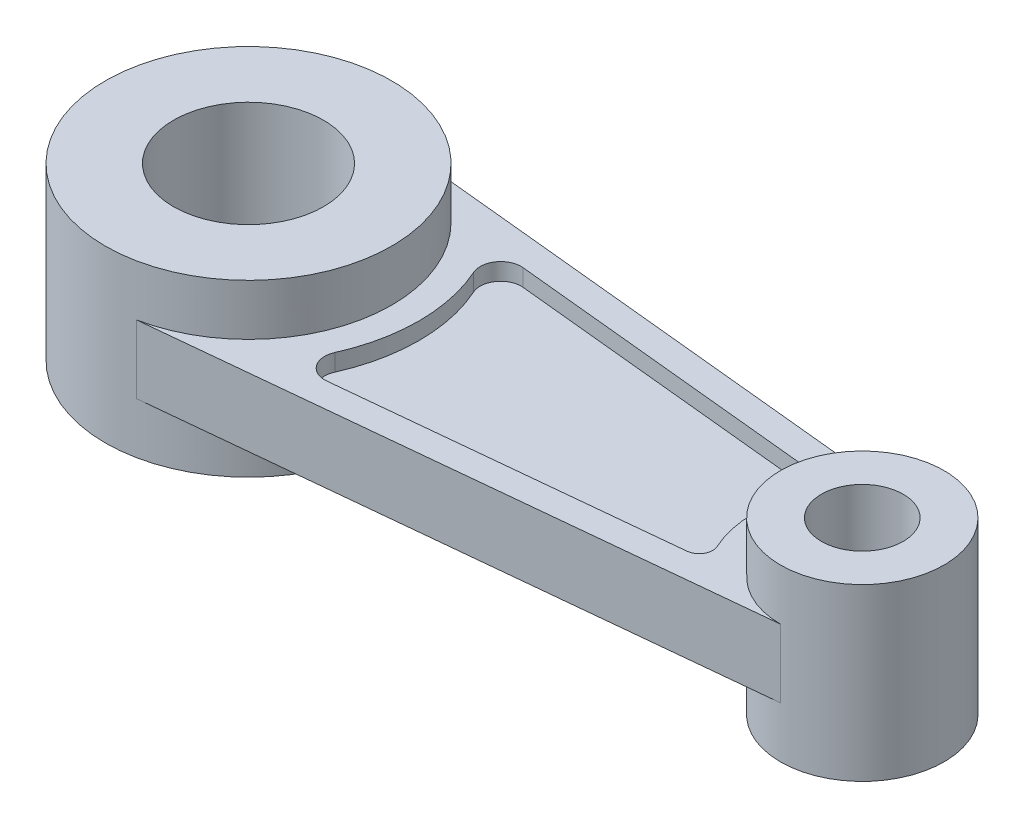
from build123d import *
from build123d.topology import SkipClean

# Parameters (mm, degrees)
BOSS_EXTRUDE1_DEPTH = 10
SKETCH2_R           = 21
SKETCH2_R_2         = 12
BOSS_EXTRUDE2_DEPTH = 17.5
BOSS_EXTRUDE3_START = 7.5
SKETCH3_R           = 21
SKETCH3_R_2         = 12
BOSS_EXTRUDE3_DEPTH = 7.5
SKETCH4_R           = 11
SKETCH4_R_2         = 6
CUT_EXTRUDE1_DEPTH  = 38.5
CUT_EXTRUDE2_DEPTH  = 2.5
CUT_EXTRUDE3_START  = -2.5
CUT_EXTRUDE3_DEPTH  = 2.5


with BuildPart() as part:
    # Sketch1 → Boss-Extrude1 (new body)
    with BuildSketch(Plane(origin=(0, 0, 0), x_dir=(1, 0, 0), z_dir=(0, 1, 0))):
        with BuildLine():
            Line((0, 21), (90, 12))
            ThreePointArc((90, 12), (102, 0), (90, -12))
            Line((90, -12), (0, -21))
            ThreePointArc((0, -21), (-21, 0), (0, 21))
        make_face()
    extrude(amount=-BOSS_EXTRUDE1_DEPTH)

    # Sketch2 → Boss-Extrude2 (add)
    with SkipClean():  # the faces are left unmerged after this step: merging them gives an invalid solid
        with BuildSketch(Plane(origin=(0, 0, 0), x_dir=(1, 0, 0), z_dir=(0, 1, 0))):
            with Locations(Location((0, 0, 0), (0, 0, 270))):
                Circle(SKETCH2_R)
            with Locations(Location((90, 0, 0), (0, 0, 270))):
                Circle(SKETCH2_R_2)
        extrude(amount=-BOSS_EXTRUDE2_DEPTH)

    # Sketch3 → Boss-Extrude3 (add)
    with SkipClean():  # the faces are left unmerged after this step: merging them gives an invalid solid
        with BuildSketch(Plane(origin=(0, 0, 0), x_dir=(1, 0, 0), z_dir=(0, 1, 0)).offset(BOSS_EXTRUDE3_START)):
            with Locations(Location((0, 0, 0), (0, 0, 270))):
                Circle(SKETCH3_R)
            with Locations(Location((90, 0, 0), (0, 0, 270))):
                Circle(SKETCH3_R_2)
        extrude(amount=-BOSS_EXTRUDE3_DEPTH)

    # Sketch4 → Cut-Extrude1 (cut)
    with SkipClean():  # the faces are left unmerged after this step: merging them gives an invalid solid
        with BuildSketch(Plane(origin=(0, 7.5, 0), x_dir=(1, 0, 0), z_dir=(0, 1, 0))):
            with Locations(Location((0, 0, 0), (0, 0, 270))):
                Circle(SKETCH4_R)
            with Locations(Location((90, 0, 0), (0, 0, 270))):
                Circle(SKETCH4_R_2)
        extrude(amount=-CUT_EXTRUDE1_DEPTH, mode=Mode.SUBTRACT)

    # Sketch5 → Cut-Extrude2 (cut)
    with SkipClean():  # the faces are left unmerged after this step: merging them gives an invalid solid
        with BuildSketch(Plane(origin=(0, 0, 0), x_dir=(1, 0, 0), z_dir=(0, 1, 0))):
            with BuildLine():
                Line((25.869138462, 14.393135905), (73.882928765, 9.591756875))
                ThreePointArc((73.882928765, 9.591756875), (75.42197475, 8.591212838), (75.496818958, 6.757051106))
                ThreePointArc((75.496818958, 6.757051106), (74, 0), (75.496818958, -6.757051106))
                ThreePointArc((75.496818958, -6.757051106), (75.42197475, -8.591212838), (73.882928765, -9.591756875))
                Line((73.882928765, -9.591756875), (25.869138462, -14.393135905))
                ThreePointArc((25.869138462, -14.393135905), (23.13846438, -13.164322574), (22.830917237, -10.185736013))
                ThreePointArc((22.830917237, -10.185736013), (25, 0), (22.830917237, 10.185736013))
                ThreePointArc((22.830917237, 10.185736013), (23.13846438, 13.164322574), (25.869138462, 14.393135905))
            make_face()
        extrude(amount=-CUT_EXTRUDE2_DEPTH, mode=Mode.SUBTRACT)

    # Sketch7 → Cut-Extrude3 (cut)
    with SkipClean():  # the faces are left unmerged after this step: merging them gives an invalid solid
        with BuildSketch(Plane.XZ.offset(10).offset(CUT_EXTRUDE3_START)):
            with BuildLine():
                Line((25.869138462, 14.393135905), (73.882928765, 9.591756875))
                ThreePointArc((73.882928765, 9.591756875), (75.42197475, 8.591212838), (75.496818958, 6.757051106))
                ThreePointArc((75.496818958, 6.757051106), (74, 0), (75.496818958, -6.757051106))
                ThreePointArc((75.496818958, -6.757051106), (75.42197475, -8.591212838), (73.882928765, -9.591756875))
                Line((73.882928765, -9.591756875), (25.869138462, -14.393135905))
                ThreePointArc((25.869138462, -14.393135905), (23.13846438, -13.164322574), (22.830917237, -10.185736013))
                ThreePointArc((22.830917237, -10.185736013), (25, 0), (22.830917237, 10.185736013))
                ThreePointArc((22.830917237, 10.185736013), (23.13846438, 13.164322574), (25.869138462, 14.393135905))
            make_face()
        extrude(amount=CUT_EXTRUDE3_DEPTH, mode=Mode.SUBTRACT)


solid = part.part
